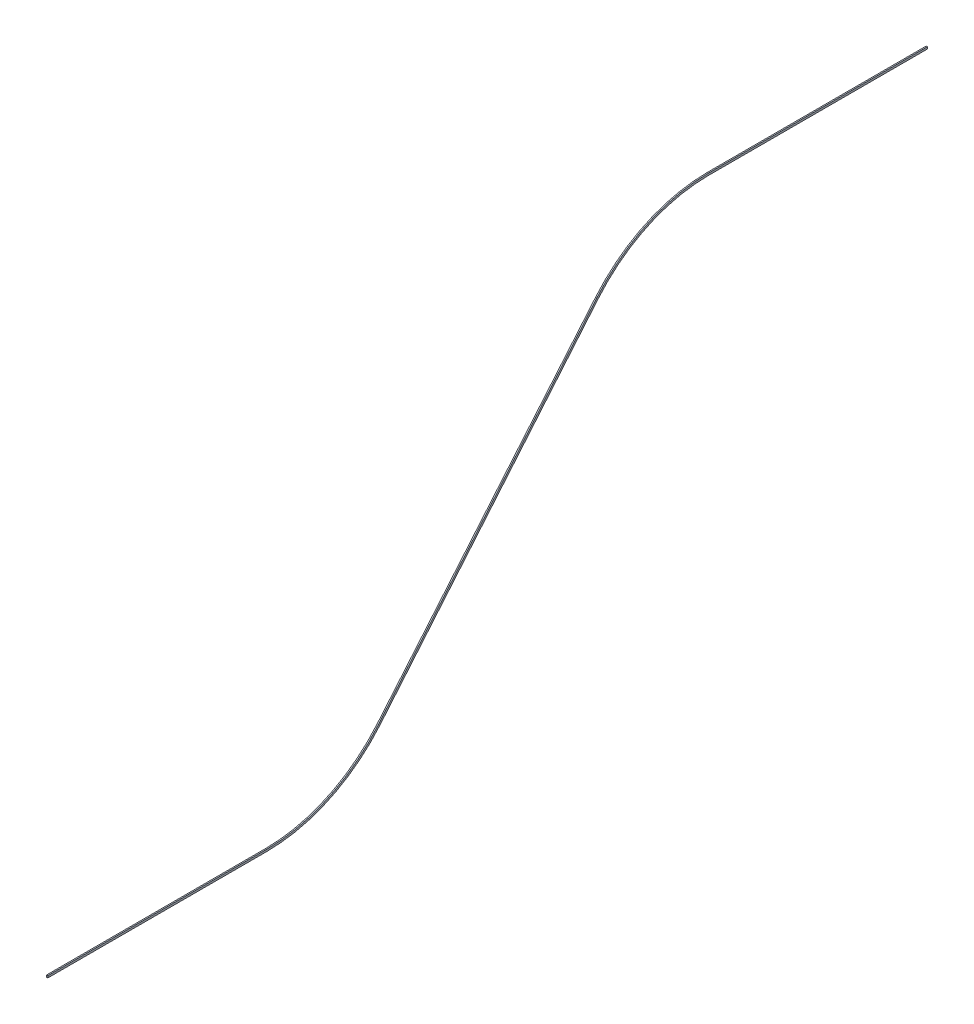
from build123d import *

# Parameters (mm, degrees)
BOSS_EXTRUDE1_DEPTH = 3.4


with BuildPart() as part:
    # Sketch1 → Boss-Extrude1 (new body)
    with BuildSketch(Plane(origin=(0, 0, 0), x_dir=(0, 0, -1), z_dir=(1, 0, 0))):
        with BuildLine():
            Line((0, 0), (600, 0))
            ThreePointArc((600, 0), (769.047304696, 37.476885185), (906.417777248, 142.884956125))
            Line((906.417777248, 142.884956125), (1505.727980454, 857.115043875))
            ThreePointArc((1505.727980454, 857.115043875), (1643.098453005, 962.523114815), (1812.145757701, 1000))
            Line((1812.145757701, 1000), (2412.145757701, 1000))
            Line((2412.145757701, 1000), (2412.145757701, 994.5))
            Line((2412.145757701, 994.5), (1812.145757701, 994.5))
            ThreePointArc((1812.145757701, 994.5), (1645.422853445, 957.538421986), (1509.941224891, 853.579712021))
            Line((1509.941224891, 853.579712021), (910.631021685, 139.349624272))
            ThreePointArc((910.631021685, 139.349624272), (771.371705136, 32.492192357), (600, -5.5))
            Line((600, -5.5), (0, -5.5))
            Line((0, -5.5), (0, 0))
        make_face()
    extrude(amount=BOSS_EXTRUDE1_DEPTH)


solid = part.part
